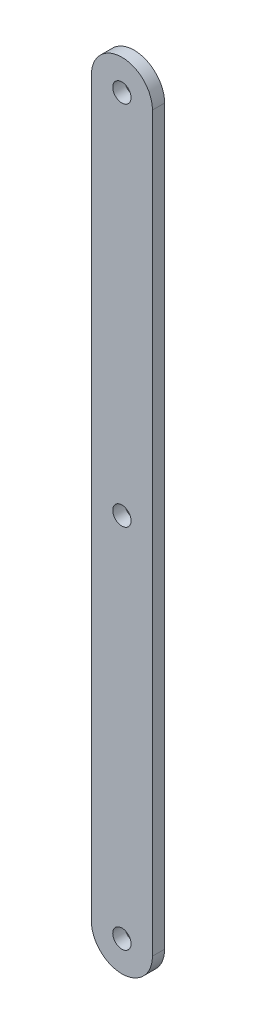
from build123d import *

# Parameters (mm, degrees)
SKETCH_1_R      = 1.5
EXTRUDE_1_DEPTH = 2


with BuildPart() as part:
    # 草图1 → 凸台-拉伸1 (new body)
    with BuildSketch(Plane.XY):
        with BuildLine():
            Line((5, 60), (5, -60))
            ThreePointArc((5, -60), (0, -65), (-5, -60))
            Line((-5, -60), (-5, 60))
            ThreePointArc((-5, 60), (0, 65), (5, 60))
        make_face()
        with Locations((0, 60)):
            Circle(SKETCH_1_R, mode=Mode.SUBTRACT)
        with Locations(Location((0, -60, 0), (0, 0, 180))):
            Circle(SKETCH_1_R, mode=Mode.SUBTRACT)
        Circle(SKETCH_1_R, mode=Mode.SUBTRACT)
    extrude(amount=EXTRUDE_1_DEPTH)


solid = part.part
